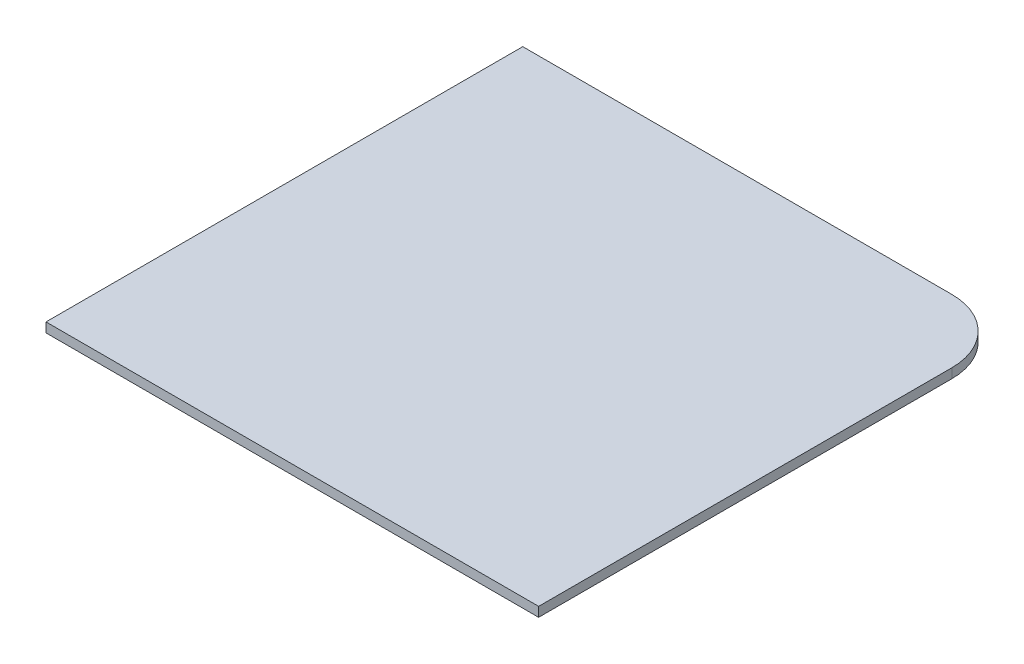
from build123d import *

# Parameters (mm, degrees)
BOSS_EXTRUDE1_DEPTH = 3


with BuildPart() as part:
    # Sketch1 → Boss-Extrude1 (new body)
    with BuildSketch(Plane(origin=(0, 0, 0), x_dir=(1, 0, 0), z_dir=(0, 1, 0))):
        with BuildLine():
            Line((-77.5, 75), (-77.5, -75))
            Line((-77.5, -75), (77.5, -75))
            Line((77.5, -75), (77.5, 55))
            ThreePointArc((77.5, 55), (71.642135624, 69.142135624), (57.5, 75))
            Line((57.5, 75), (-77.5, 75))
        make_face()
    extrude(amount=BOSS_EXTRUDE1_DEPTH)


solid = part.part
